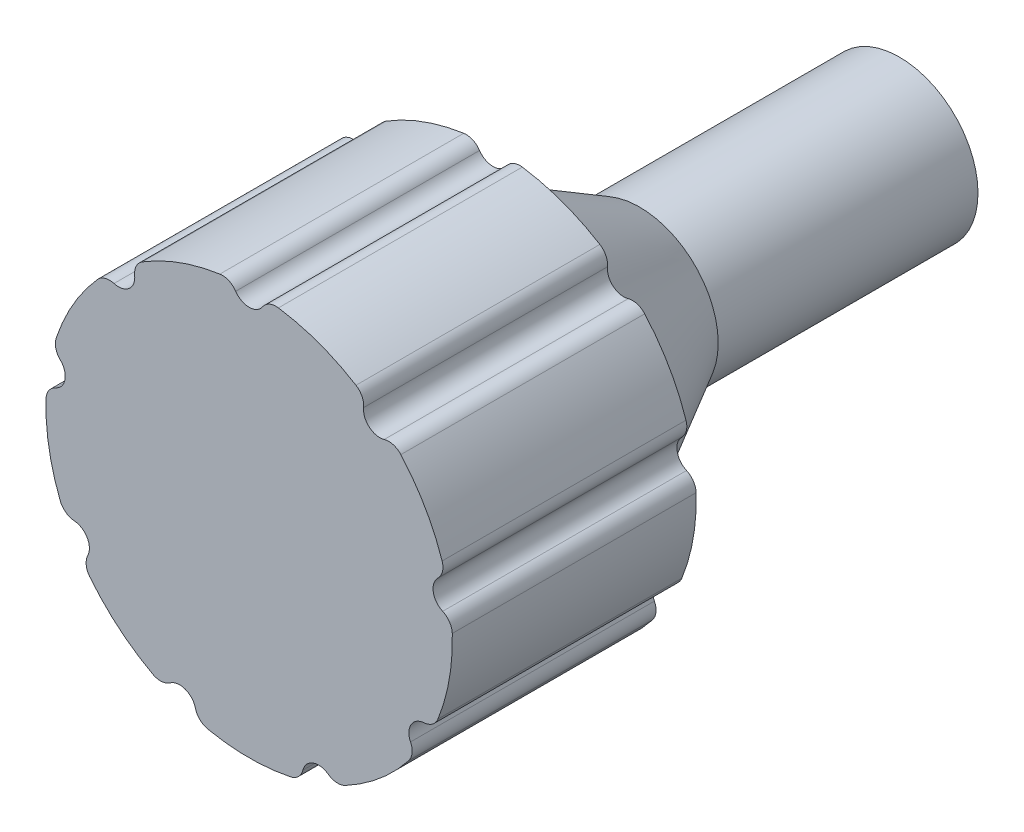
from build123d import *

# Parameters (mm, degrees)
SKETCH_1_R          = 4.829016319
EXTRUDE_1_DEPTH     = 10
SKETCH_2_R          = 4.829016319
EXTRUDE_2_DEPTH     = 15
SKETCH_3_R          = 12.5
EXTRUDE_3_DEPTH     = 15
CHAMFER_1_SIZE      = 5
CHAMFER_1_SIZE2     = 9.020238776
SKETCH_4_R          = 1
CUT_EXTRUDE_1_DEPTH = 44.732139211
FILLET_1_R          = 1


with BuildPart() as part:
    # Эскиз1 → Бобышка-Вытянуть1 (new body)
    with BuildSketch(Plane.XY):
        Circle(SKETCH_1_R)
        Polygon((0, 2.829016319), (2.45, 1.41450816), (2.45, -1.41450816), (0, -2.829016319), (-2.45, -1.41450816), (-2.45, 1.41450816), align=None, mode=Mode.SUBTRACT)
    extrude(amount=EXTRUDE_1_DEPTH)

    # Эскиз2 → Бобышка-Вытянуть2 (add)
    with BuildSketch(Plane.XY.offset(10)):
        Circle(SKETCH_2_R)
    extrude(amount=EXTRUDE_2_DEPTH)

    # Эскиз3 → Бобышка-Вытянуть3 (add)
    with BuildSketch(Plane.XY.offset(25)):
        Circle(SKETCH_3_R)
    extrude(amount=EXTRUDE_3_DEPTH)

    # Фаска1
    chamfer_1_edges = [part.edges().sort_by_distance(p)[0] for p in [
        (-4.829016319, 0, 25),
    ]]
    chamfer_1_side = [part.faces().sort_by_distance(p)[0] for p in [
        (-12.146446609, 0, 25),
    ]]
    chamfer(chamfer_1_edges, length=CHAMFER_1_SIZE, length2=CHAMFER_1_SIZE2, reference=chamfer_1_side[0])

    # Эскиз4 → Вырез-Вытянуть1 (cut, through all)
    with BuildSketch(Plane.XY.offset(40)):
        with Locations((0, 12.5)):
            Circle(SKETCH_4_R)
        with Locations((8.034845121, 9.575555539)):
            Circle(SKETCH_4_R)
        with Locations((12.310096913, 2.170602221)):
            Circle(SKETCH_4_R)
        with Locations((10.825317547, -6.25)):
            Circle(SKETCH_4_R)
        with Locations((4.275251792, -11.74615776)):
            Circle(SKETCH_4_R)
        with Locations((-4.275251792, -11.74615776)):
            Circle(SKETCH_4_R)
        with Locations((-10.825317547, -6.25)):
            Circle(SKETCH_4_R)
        with Locations((-12.310096913, 2.170602221)):
            Circle(SKETCH_4_R)
        with Locations((-8.034845121, 9.575555539)):
            Circle(SKETCH_4_R)
    extrude(amount=-CUT_EXTRUDE_1_DEPTH, mode=Mode.SUBTRACT)

    # Скругление1
    fillet_1_edges = [part.edges().sort_by_distance(p)[0] for p in [
        (0.99919968, 12.46, 32.5),
        (-0.99919968, 12.46, 32.5),
        (8.774564979, 8.902640588, 32.5),
        (7.243702254, 10.187186935, 32.5),
        (12.444213806, 1.179636702, 32.5),
        (12.097195399, 3.147675885, 32.5),
        (10.291076691, -7.095332306, 32.5),
        (11.290276371, -5.364667694, 32.5),
        (3.32263042, -12.050316473, 32.5),
        (5.200511552, -11.366823637, 32.5),
        (-5.200511552, -11.366823637, 32.5),
        (-3.32263042, -12.050316473, 32.5),
        (-11.290276371, -5.364667694, 32.5),
        (-10.291076691, -7.095332306, 32.5),
        (-12.097195399, 3.147675885, 32.5),
        (-12.444213806, 1.179636702, 32.5),
        (-7.243702254, 10.187186935, 32.5),
        (-8.774564979, 8.902640588, 32.5),
    ]]
    fillet(fillet_1_edges, radius=FILLET_1_R)


solid = part.part
